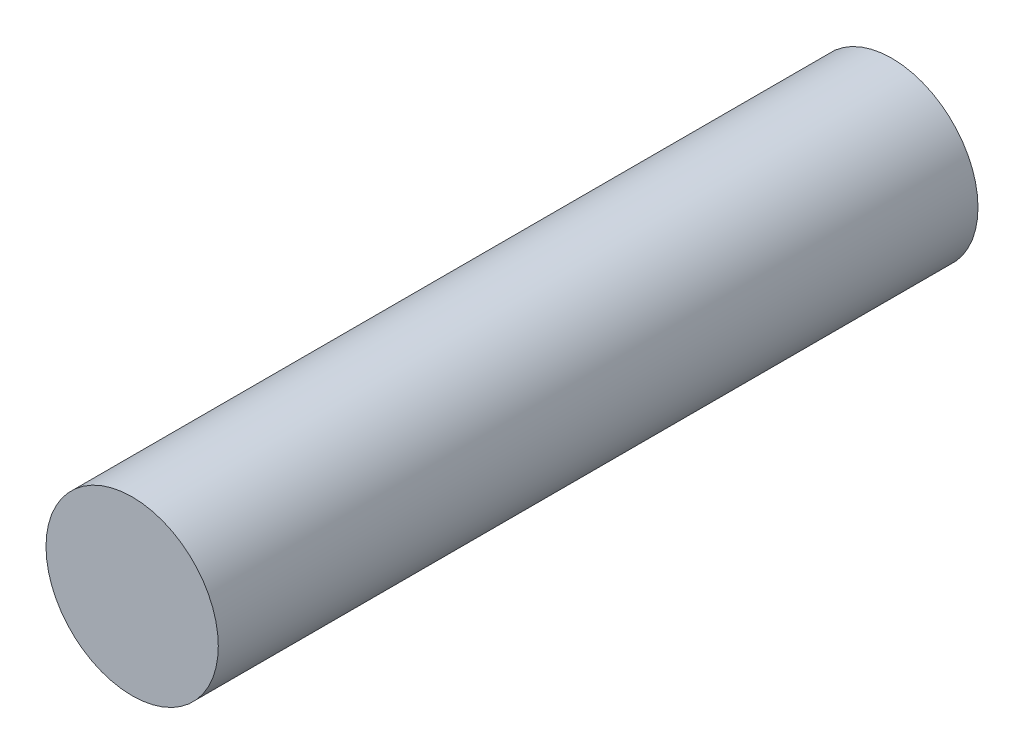
from build123d import *

# Parameters (mm, degrees)
SKETCH2_R           = 5.5
BOSS_EXTRUDE1_DEPTH = 48.5


with BuildPart() as part:
    # Sketch2 → Boss-Extrude1 (new body)
    with BuildSketch(Plane.XY):
        with Locations(Location((0, 0, 0), (0, 0, 180))):
            Circle(SKETCH2_R)
    extrude(amount=BOSS_EXTRUDE1_DEPTH)


solid = part.part
